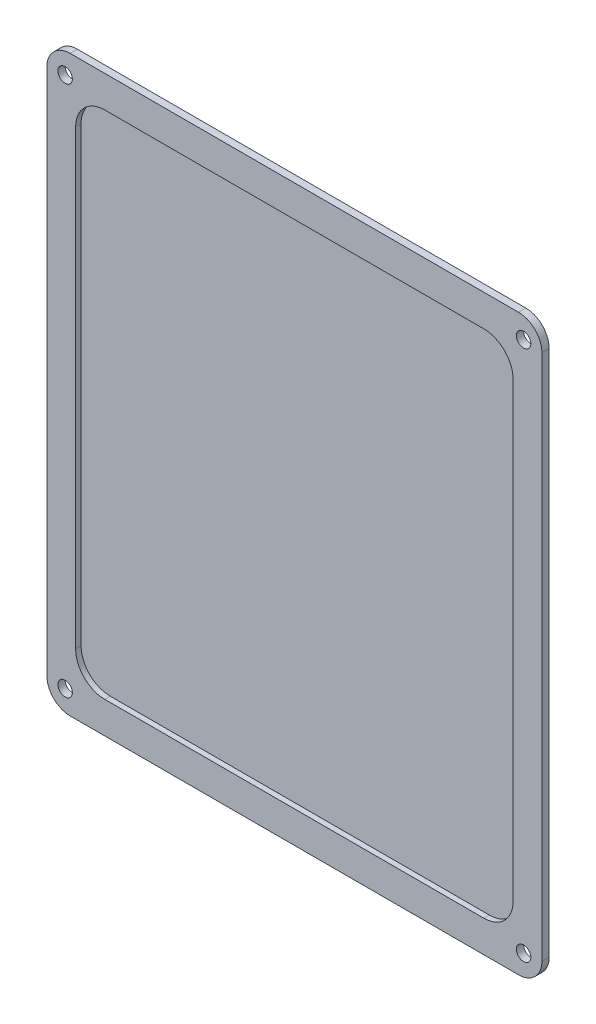
from build123d import *

# Parameters (mm, degrees)
SKETCH1_W           = 107.786447668
SKETCH1_H           = 124.928058302
SKETCH1_R           = 1.5748
BOSS_EXTRUDE1_DEPTH = 1.5875
FILLET1_R           = 5.08
CUT_EXTRUDE1_DEPTH  = 83.515178417
SKETCH6_W           = 95.25
SKETCH6_H           = 111.125
BOSS_EXTRUDE2_DEPTH = 0.396875


with BuildPart() as part:
    # Sketch1 → Boss-Extrude1 (new body)
    with BuildSketch(Plane.XY):
        Rectangle(SKETCH1_W, SKETCH1_H)
        with Locations((-49.911, 57.8485)):
            Circle(SKETCH1_R, mode=Mode.SUBTRACT)
        with Locations((49.911, 57.8485)):
            Circle(SKETCH1_R, mode=Mode.SUBTRACT)
        with Locations((49.911, -57.8485)):
            Circle(SKETCH1_R, mode=Mode.SUBTRACT)
        with Locations((-49.911, -57.8485)):
            Circle(SKETCH1_R, mode=Mode.SUBTRACT)
    extrude(amount=BOSS_EXTRUDE1_DEPTH)

    # Fillet1
    fillet1_edges = [part.edges().sort_by_distance(p)[0] for p in [
        (-53.893223834, 62.464029151, 0.79375),
        (53.893223834, 62.464029151, 0.79375),
        (53.893223834, -62.464029151, 0.79375),
        (-53.893223834, -62.464029151, 0.79375),
    ]]
    fillet(fillet1_edges, radius=FILLET1_R)

    # Sketch4 → Cut-Extrude1 (cut, through all)
    with BuildSketch(Plane.XY.offset(1.5875)):
        with BuildLine():
            Line((41.275, 55.5625), (-41.275, 55.5625))
            ThreePointArc((-41.275, 55.5625), (-45.765128061, 53.702628061), (-47.625, 49.2125))
            Line((-47.625, 49.2125), (-47.625, -49.2125))
            ThreePointArc((-47.625, -49.2125), (-45.765128061, -53.702628061), (-41.275, -55.5625))
            Line((-41.275, -55.5625), (41.275, -55.5625))
            ThreePointArc((41.275, -55.5625), (45.765128061, -53.702628061), (47.625, -49.2125))
            Line((47.625, -49.2125), (47.625, 49.2125))
            ThreePointArc((47.625, 49.2125), (45.765128061, 53.702628061), (41.275, 55.5625))
        make_face()
    extrude(amount=-CUT_EXTRUDE1_DEPTH, mode=Mode.SUBTRACT)

    # Sketch6 → Boss-Extrude2 (add)
    with BuildSketch(Plane(origin=(0, 0, 0), x_dir=(-1, 0, 0), z_dir=(0, 0, -1))):
        Rectangle(SKETCH6_W, SKETCH6_H)
    extrude(amount=-BOSS_EXTRUDE2_DEPTH)


solid = part.part
